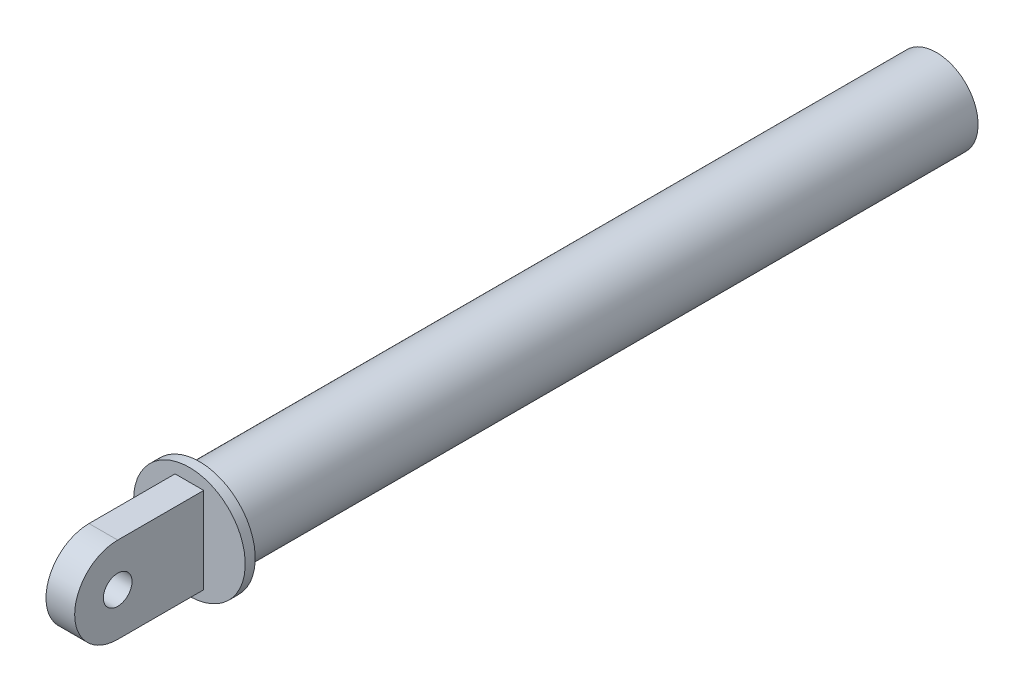
from build123d import *

# Parameters (mm, degrees)
SKETCH1_R           = 5
BOSS_EXTRUDE1_DEPTH = 5


with BuildPart() as part:
    # Sketch1 → Boss-Extrude1 (new, symmetric)
    with BuildSketch(Plane(origin=(0, 0, 0), x_dir=(0, 0, -1), z_dir=(1, 0, 0))):
        with BuildLine():
            Line((0, 15), (30, 15))
            Line((30, 15), (30, -15))
            Line((30, -15), (0, -15))
            ThreePointArc((0, -15), (-15, 0), (0, 15))
        make_face()
        Circle(SKETCH1_R, mode=Mode.SUBTRACT)
    extrude(amount=BOSS_EXTRUDE1_DEPTH, both=True)

    # Sketch2 → Revolve1 (revolve)
    with BuildSketch(Plane(origin=(0, 0, 0), x_dir=(0, 0, -1), z_dir=(1, 0, 0)), mode=Mode.PRIVATE) as revolve1_sk:
        Polygon((30, 0), (30, 19.46387593), (33.500252175, 19.46387593), (33.500252175, 14.525280545), (290.484846339, 14.525280545), (290.484846339, 0), align=None)
    revolve(revolve1_sk.sketch.rotate(Axis((0, 0, -290.484846339), (0, 0, 1)), 90), axis=Axis((0, 0, -290.484846339), (0, 0, 1)))


solid = part.part
